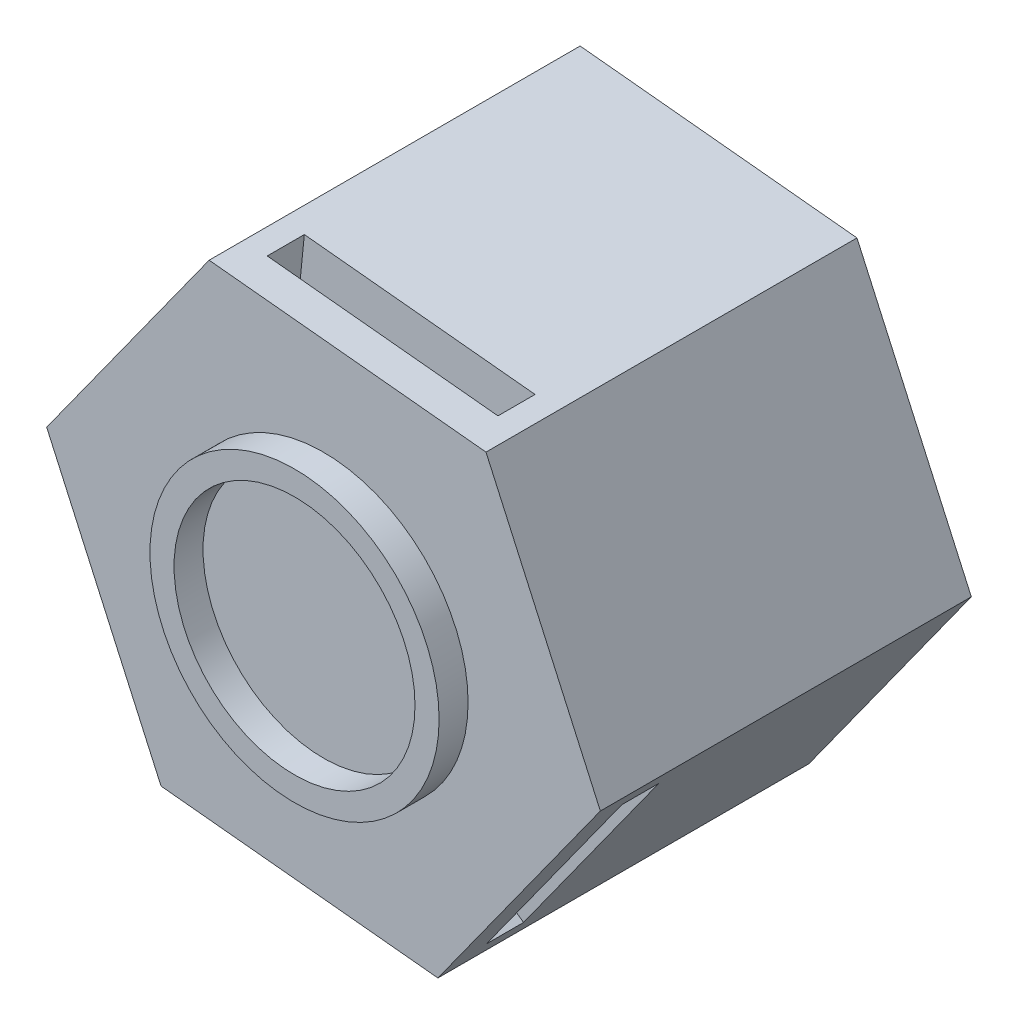
from build123d import *

# Parameters (mm, degrees)
Y_KSEKLIK_EKSTR_ZYON1_DEPTH      = 2
Y_KSEKLIK_EKSTR_ZYON1_DEPTH_BACK = 30
IZIM1_R                          = 12.470765814
Y_KSEKLIK_EKSTR_ZYON2_DEPTH      = 4.5
Y_KSEKLIK_EKSTR_ZYON2_DEPTH_BACK = 30
IZIM1_3_R                        = 12.470765814
IZIM1_3_R_2                      = 10.392304845
Y_KSEKLIK_EKSTR_ZYON3_DEPTH      = 2
Y_KSEKLIK_EKSTR_ZYON3_DEPTH_BACK = 30
IZIM1_4_R                        = 10.392304845
IZIM4_W                          = 3.2
IZIM4_H                          = 20
KES_EKSTR_ZYON1_DEPTH            = 5
DAIRESEL_KAPLAMA1_COUNT          = 3
IZIM6_R                          = 6
IZIM5_R                          = 4


with BuildPart() as part:
    # Çizim1 → Yükseklik-Ekstrüzyon1 (new, two sides: drawn at the far end of the back side and taken through both)
    with BuildSketch(Plane.XY.offset(-Y_KSEKLIK_EKSTR_ZYON1_DEPTH_BACK)):
        Polygon((-23.880099845, 2.396003215), (-14.015049574, -19.482771503), (9.86505027, -21.878774718), (23.880099845, -2.396003215), (14.015049574, 19.482771503), (-9.86505027, 21.878774718), align=None)
        Circle(IZIM1_R, mode=Mode.SUBTRACT)
    extrude(amount=Y_KSEKLIK_EKSTR_ZYON1_DEPTH + Y_KSEKLIK_EKSTR_ZYON1_DEPTH_BACK)

    # Çizim1<3> → Yükseklik-Ekstrüzyon2 (add, two sides: drawn at the far end of the back side and taken through both)
    with BuildSketch(Plane.XY.offset(-Y_KSEKLIK_EKSTR_ZYON2_DEPTH_BACK)):
        Circle(IZIM1_3_R)
        Circle(IZIM1_3_R_2, mode=Mode.SUBTRACT)
    extrude(amount=Y_KSEKLIK_EKSTR_ZYON2_DEPTH + Y_KSEKLIK_EKSTR_ZYON2_DEPTH_BACK)

    # Çizim1<4> → Yükseklik-Ekstrüzyon3 (add, two sides: drawn at the far end of the back side and taken through both)
    with BuildSketch(Plane.XY.offset(-Y_KSEKLIK_EKSTR_ZYON3_DEPTH_BACK)):
        Circle(IZIM1_4_R)
    extrude(amount=Y_KSEKLIK_EKSTR_ZYON3_DEPTH + Y_KSEKLIK_EKSTR_ZYON3_DEPTH_BACK)

    # Çizim4 → Kes-Ekstrüzyon1 (cut)
    with BuildSketch(Plane(origin=(16.872575058, -12.137388967, 0), x_dir=(0, 0, -1), z_dir=(0.8117821459477176, -0.5839603989317416, 0))):
        with Locations((2.622089109, 0)):
            Rectangle(IZIM4_W, IZIM4_H)
    kes_ekstr_zyon1 = extrude(amount=-KES_EKSTR_ZYON1_DEPTH, mode=Mode.SUBTRACT)

    # Dairesel Kaplama1: Kes-Ekstrüzyon1 ×3 about axis
    dairesel_kaplama1_axis = Axis((0, 0, 0), (0, 0, 1))
    for i in range(1, DAIRESEL_KAPLAMA1_COUNT):
        add(kes_ekstr_zyon1.rotate(dairesel_kaplama1_axis, i * 360 / DAIRESEL_KAPLAMA1_COUNT), mode=Mode.SUBTRACT)

    # Çizim6 → Loft1 section 0
    with BuildSketch(Plane(origin=(0, 0, -41), x_dir=(-1, 0, 0), z_dir=(0, 0, -1))):
        Circle(IZIM6_R)
    # Çizim5 → Loft1 section 1
    with BuildSketch(Plane(origin=(0, 0, -30), x_dir=(-1, 0, 0), z_dir=(0, 0, -1))):
        Circle(IZIM5_R)
    loft()


solid = part.part
